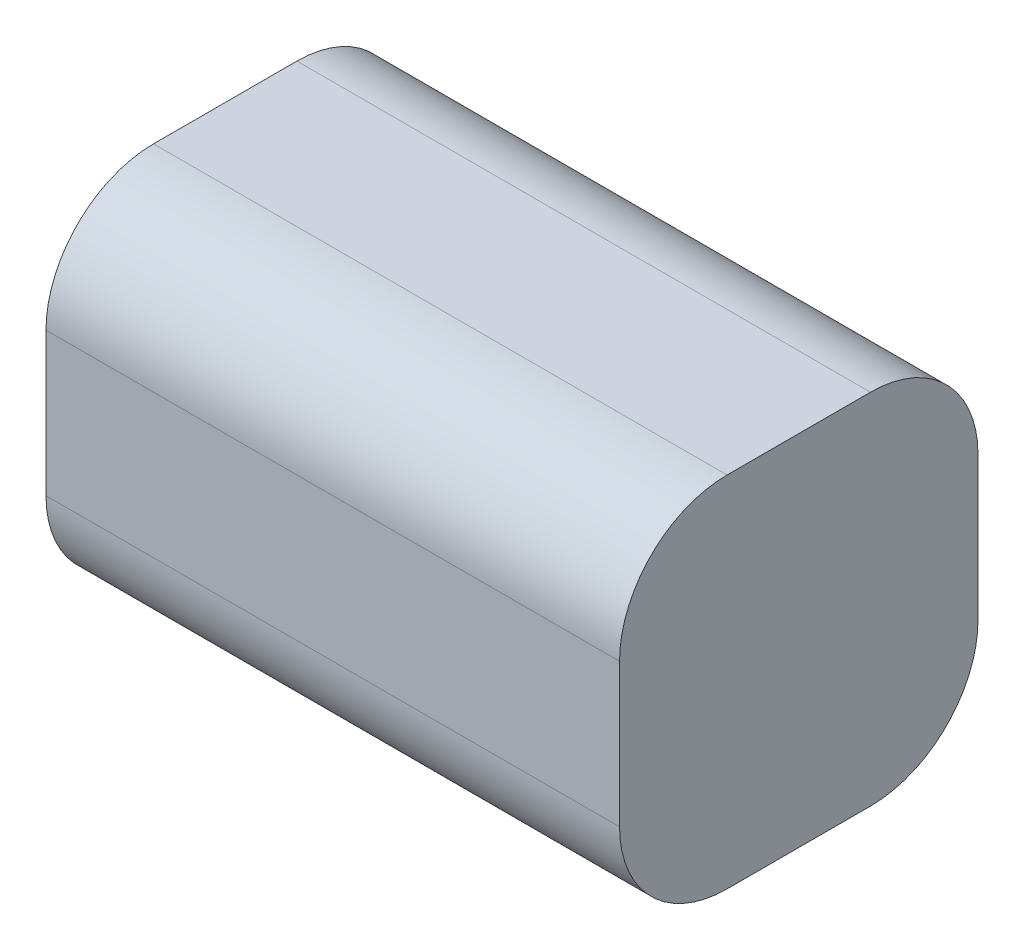
from build123d import *

# Parameters (mm, degrees)
SKETCH_1_W      = 16
SKETCH_1_H      = 10
EXTRUDE_1_DEPTH = 10
FILLET_1_R      = 3


with BuildPart() as part:
    # 草图1 → 凸台-拉伸1 (new body)
    with BuildSketch(Plane.XY):
        Rectangle(SKETCH_1_W, SKETCH_1_H)
    extrude(amount=EXTRUDE_1_DEPTH)

    # 圆角1
    fillet_1_edges = [part.edges().sort_by_distance(p)[0] for p in [
        (0, -5, 10),
        (0, -5, 0),
        (0, 5, 0),
        (0, 5, 10),
    ]]
    fillet(fillet_1_edges, radius=FILLET_1_R)


solid = part.part
